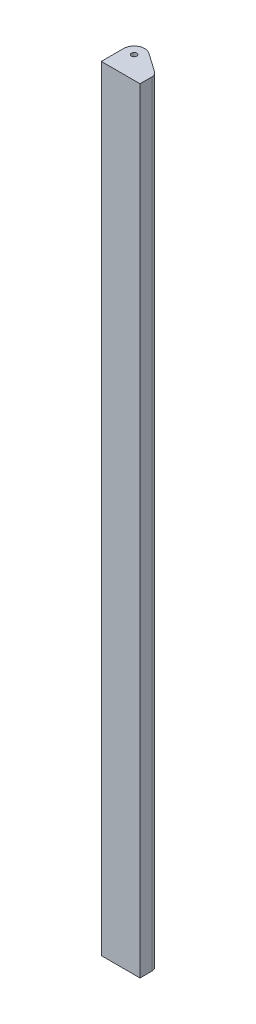
from build123d import *

# Parameters (mm, degrees)
SKETCH1_R           = 4.7625
BOSS_EXTRUDE1_DEPTH = 1397


with BuildPart() as part:
    # Sketch1 → Boss-Extrude1 (new body)
    with BuildSketch(Plane(origin=(0, 0, 0), x_dir=(1, 0, 0), z_dir=(0, 1, 0))):
        with BuildLine():
            ThreePointArc((29.976631112, 55.849090528), (10.253688918, 57.141800456), (0, 40.244244084))
            Line((0, 40.244244084), (0, 0))
            Line((0, 0), (69.85, 0))
            Line((69.85, 0), (69.85, 21.318255517))
            ThreePointArc((69.85, 21.318255517), (68.415037581, 27.182462905), (64.434420742, 31.721486479))
            Line((64.434420742, 31.721486479), (29.976631112, 55.849090528))
        make_face()
        with Locations(Location((19.05, 40.244244084, 0), (0, 0, 270))):
            Circle(SKETCH1_R, mode=Mode.SUBTRACT)
    extrude(amount=BOSS_EXTRUDE1_DEPTH)


solid = part.part
